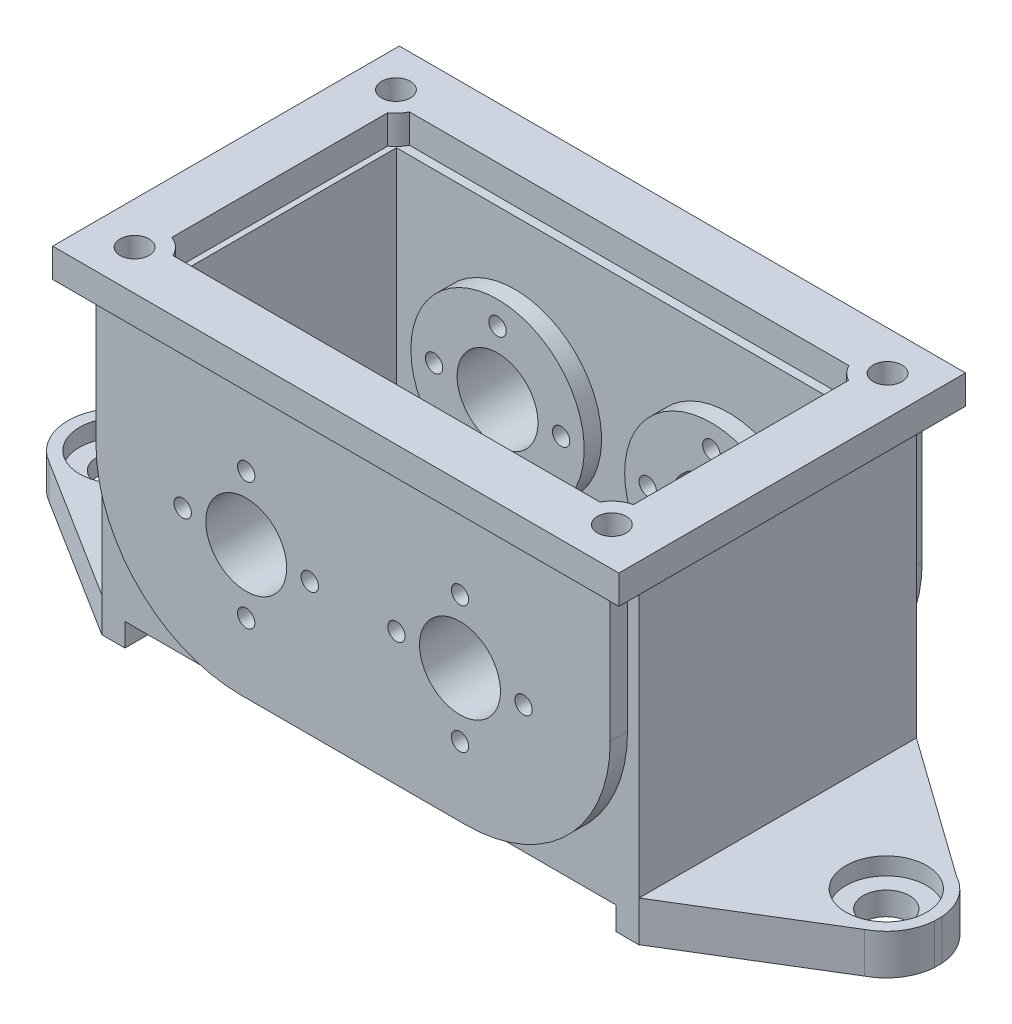
from build123d import *

# Parameters (mm, degrees)
SKETCH1_W            = 93
SKETCH1_H            = 48
BOSS_EXTRUDE1_DEPTH  = 25.5
BOSS_EXTRUDE4_DEPTH  = 3
BOSS_EXTRUDE5_START  = 3
BOSS_EXTRUDE5_DEPTH  = 3
SKETCH5_W            = 78
SKETCH5_H            = 39
CUT_EXTRUDE1_DEPTH   = 44
SKETCH6_W            = 48.017272351
SKETCH6_H            = 7
BOSS_EXTRUDE6_DEPTH  = 29
SKETCH7_W            = 48
SKETCH7_H            = 5.960965096
BOSS_EXTRUDE7_DEPTH  = 29
CUT_EXTRUDE2_DEPTH   = 29
CUT_EXTRUDE3_DEPTH   = 29
SKETCH10_R           = 15
BOSS_EXTRUDE8_DEPTH  = 10.5
SKETCH11_R           = 15
BOSS_EXTRUDE9_DEPTH  = 10.5
SKETCH12_W           = 4
SKETCH12_H           = 48
BOSS_EXTRUDE10_DEPTH = 4
SKETCH13_W           = 4
SKETCH13_H           = 48
BOSS_EXTRUDE11_DEPTH = 4
SKETCH14_R           = 15
BOSS_EXTRUDE12_DEPTH = 10.5
SKETCH15_R           = 15
BOSS_EXTRUDE13_DEPTH = 10.5
SKETCH17_R           = 7
CUT_EXTRUDE4_DEPTH   = 10.5
CUT_EXTRUDE5_START   = -10.5
SKETCH18_R           = 7
CUT_EXTRUDE5_DEPTH   = 10.5
SKETCH19_R           = 7
CUT_EXTRUDE6_DEPTH   = 10.5
CUT_EXTRUDE7_START   = -10.5
SKETCH20_R           = 7
CUT_EXTRUDE7_DEPTH   = 10.5
SKETCH21_R           = 1.5
CUT_EXTRUDE8_DEPTH   = 10.5
SKETCH22_R           = 1.5
CUT_EXTRUDE9_DEPTH   = 89.5
SKETCH23_R           = 1.5
CUT_EXTRUDE10_DEPTH  = 89.5
SKETCH24_R           = 1.5
CUT_EXTRUDE11_DEPTH  = 89.5
CUT_EXTRUDE12_START  = -89.5
SKETCH25_R           = 1.5
CUT_EXTRUDE12_DEPTH  = 89.5
SKETCH26_R           = 1.5
CUT_EXTRUDE13_DEPTH  = 89.5
SKETCH27_R           = 1.5
CUT_EXTRUDE14_DEPTH  = 89.5
SKETCH28_R           = 1.5
CUT_EXTRUDE15_DEPTH  = 89.5
SKETCH29_R           = 1.5
CUT_EXTRUDE16_DEPTH  = 89.5
SKETCH30_W           = 98
SKETCH30_H           = 60
BOSS_EXTRUDE14_DEPTH = 5
SKETCH31_W           = 80
SKETCH31_H           = 42
CUT_EXTRUDE18_DEPTH  = 5
SKETCH32_R           = 5
BOSS_EXTRUDE16_DEPTH = 4
SKETCH33_R           = 5
BOSS_EXTRUDE18_DEPTH = 6
SKETCH34_R           = 5
BOSS_EXTRUDE19_DEPTH = 5
SKETCH35_R           = 5
BOSS_EXTRUDE20_DEPTH = 4
SKETCH36_R           = 2.5
CUT_EXTRUDE19_DEPTH  = 4
SKETCH37_R           = 2.5
CUT_EXTRUDE20_DEPTH  = 4
SKETCH38_R           = 2.5
CUT_EXTRUDE21_DEPTH  = 4
SKETCH39_R           = 2.5
CUT_EXTRUDE22_DEPTH  = 4
SKETCH40_R           = 7
CUT_EXTRUDE23_DEPTH  = 3
SKETCH41_R           = 7
CUT_EXTRUDE24_DEPTH  = 3
SKETCH42_R           = 4
CUT_EXTRUDE25_DEPTH  = 3
SKETCH43_R           = 4
CUT_EXTRUDE26_DEPTH  = 4


with BuildPart() as part:
    # Sketch1 → Boss-Extrude1 (new, symmetric)
    with BuildSketch(Plane(origin=(0, 0, 0), x_dir=(1, 0, 0), z_dir=(0, 1, 0))):
        Rectangle(SKETCH1_W, SKETCH1_H)
    extrude(amount=BOSS_EXTRUDE1_DEPTH, both=True)

    # Sketch3 → Boss-Extrude4 (add)
    with BuildSketch(Plane.XY.offset(24)):
        with BuildLine():
            Line((-44.5, 25.5), (-44.5, 1.5))
            ThreePointArc((-44.5, 1.5), (-37.17766953, -16.17766953), (-19.5, -23.5))
            Line((-19.5, -23.5), (19.5, -23.5))
            ThreePointArc((19.5, -23.5), (37.17766953, -16.17766953), (44.5, 1.5))
            Line((44.5, 1.5), (44.5, 25.5))
            Line((44.5, 25.5), (-44.5, 25.5))
        make_face()
    extrude(amount=BOSS_EXTRUDE4_DEPTH)

    # Sketch4 → Boss-Extrude5 (add)
    with BuildSketch(Plane(origin=(0, 0, -24), x_dir=(-1, 0, 0), z_dir=(0, 0, -1)).offset(BOSS_EXTRUDE5_START)):
        with BuildLine():
            Line((-44.5, 25.5), (-44.5, 1.5))
            ThreePointArc((-44.5, 1.5), (-37.17766953, -16.17766953), (-19.5, -23.5))
            Line((-19.5, -23.5), (19.5, -23.5))
            ThreePointArc((19.5, -23.5), (37.17766953, -16.17766953), (44.5, 1.5))
            Line((44.5, 1.5), (44.5, 25.5))
            Line((44.5, 25.5), (-44.5, 25.5))
        make_face()
    extrude(amount=-BOSS_EXTRUDE5_DEPTH)

    # Sketch5 → Cut-Extrude1 (cut)
    with BuildSketch(Plane(origin=(0, 25.5, 0), x_dir=(1, 0, 0), z_dir=(0, 1, 0))):
        Rectangle(SKETCH5_W, SKETCH5_H)
    extrude(amount=-CUT_EXTRUDE1_DEPTH, mode=Mode.SUBTRACT)

    # Sketch6 → Boss-Extrude6 (add)
    with BuildSketch(Plane(origin=(46.5, 0, 0), x_dir=(0, 0, -1), z_dir=(1, 0, 0))):
        with Locations((0.008636176, -25.960965096)):
            Rectangle(SKETCH6_W, SKETCH6_H)
    extrude(amount=BOSS_EXTRUDE6_DEPTH)

    # Sketch7 → Boss-Extrude7 (add)
    with BuildSketch(Plane.ZY.offset(46.5)):
        with Locations((0, -26.480482548)):
            Rectangle(SKETCH7_W, SKETCH7_H)
    extrude(amount=BOSS_EXTRUDE7_DEPTH)

    # Sketch8 → Cut-Extrude2 (cut)
    with BuildSketch(Plane(origin=(0, -22.460965096, 0), x_dir=(1, 0, 0), z_dir=(0, 1, 0))):
        with BuildLine():
            Line((75.5, -24), (75.5, -1.910676326))
            ThreePointArc((75.5, -1.910676326), (74.051472635, -6.171697745), (70.72097804, -9.198633622))
            Line((70.72097804, -9.198633622), (46.5, -24))
            Line((46.5, -24), (75.5, -24))
        make_face()
        with BuildLine():
            Line((46.5, 24), (70.72097804, 6.725711938))
            ThreePointArc((70.72097804, 6.725711938), (74.051472635, 3.698776061), (75.5, -0.562245358))
            Line((75.5, -0.562245358), (75.5, 24.017272351))
            Line((75.5, 24.017272351), (46.5, 24.017272351))
            Line((46.5, 24.017272351), (46.5, 24))
        make_face()
    extrude(amount=-CUT_EXTRUDE2_DEPTH, mode=Mode.SUBTRACT)

    # Sketch9 → Cut-Extrude3 (cut)
    with BuildSketch(Plane(origin=(0, -23.5, 0), x_dir=(1, 0, 0), z_dir=(0, 1, 0))):
        with BuildLine():
            ThreePointArc((-75.5, -0.15840749), (-74.337484046, 3.643435469), (-71.650459264, 6.57351244))
            Line((-71.650459264, 6.57351244), (-46.5, 24))
            Line((-46.5, 24), (-75.5, 24))
            Line((-75.5, 24), (-75.5, -0.15840749))
        make_face()
        with BuildLine():
            Line((-46.5, -24), (-70.954604818, -8.658460386))
            ThreePointArc((-70.954604818, -8.658460386), (-74.125458012, -5.643733646), (-75.5, -1.489997784))
            Line((-75.5, -1.489997784), (-75.5, -24))
            Line((-75.5, -24), (-46.5, -24))
        make_face()
    extrude(amount=-CUT_EXTRUDE3_DEPTH, mode=Mode.SUBTRACT)

    # Sketch10 → Boss-Extrude8 (add)
    with BuildSketch(Plane(origin=(0, 0, -27), x_dir=(-1, 0, 0), z_dir=(0, 0, -1))):
        with Locations((-18.5, -0.460965096)):
            Circle(SKETCH10_R)
    extrude(amount=-BOSS_EXTRUDE8_DEPTH)

    # Sketch11 → Boss-Extrude9 (add)
    with BuildSketch(Plane(origin=(0, 0, -27), x_dir=(-1, 0, 0), z_dir=(0, 0, -1))):
        with Locations((18.5, -0.460965096)):
            Circle(SKETCH11_R)
    extrude(amount=-BOSS_EXTRUDE9_DEPTH)

    # Sketch12 → Boss-Extrude10 (add)
    with BuildSketch(Plane.XZ.offset(25.5)):
        with Locations((-44.5, 0)):
            Rectangle(SKETCH12_W, SKETCH12_H)
    extrude(amount=BOSS_EXTRUDE10_DEPTH)

    # Sketch13 → Boss-Extrude11 (add)
    with BuildSketch(Plane.XZ.offset(25.5)):
        with Locations((44.5, 0)):
            Rectangle(SKETCH13_W, SKETCH13_H)
    extrude(amount=BOSS_EXTRUDE11_DEPTH)

    # Sketch14 → Boss-Extrude12 (add)
    with BuildSketch(Plane.XY.offset(27)):
        with Locations((-18.5, -0.5)):
            Circle(SKETCH14_R)
    extrude(amount=-BOSS_EXTRUDE12_DEPTH)

    # Sketch15 → Boss-Extrude13 (add)
    with BuildSketch(Plane.XY.offset(27)):
        with Locations((18.5, -0.5)):
            Circle(SKETCH15_R)
    extrude(amount=-BOSS_EXTRUDE13_DEPTH)

    # Sketch17 → Cut-Extrude4 (cut)
    with BuildSketch(Plane(origin=(0, 0, 16.5), x_dir=(-1, 0, 0), z_dir=(0, 0, -1))):
        with Locations((18.5, -0.5)):
            Circle(SKETCH17_R)
    extrude(amount=-CUT_EXTRUDE4_DEPTH, mode=Mode.SUBTRACT)

    # Sketch18 → Cut-Extrude5 (cut)
    with BuildSketch(Plane.XY.offset(-16.5).offset(CUT_EXTRUDE5_START)):
        with Locations((-18.5, -0.5)):
            Circle(SKETCH18_R)
    extrude(amount=CUT_EXTRUDE5_DEPTH, mode=Mode.SUBTRACT)

    # Sketch19 → Cut-Extrude6 (cut)
    with BuildSketch(Plane.XY.offset(-16.5)):
        with Locations((18.5, -0.5)):
            Circle(SKETCH19_R)
    extrude(amount=-CUT_EXTRUDE6_DEPTH, mode=Mode.SUBTRACT)

    # Sketch20 → Cut-Extrude7 (cut)
    with BuildSketch(Plane(origin=(0, 0, 16.5), x_dir=(-1, 0, 0), z_dir=(0, 0, -1)).offset(CUT_EXTRUDE7_START)):
        with Locations((-18.5, -0.5)):
            Circle(SKETCH20_R)
    extrude(amount=CUT_EXTRUDE7_DEPTH, mode=Mode.SUBTRACT)

    # Sketch21 → Cut-Extrude8 (cut)
    with BuildSketch(Plane.XY.offset(27)):
        with Locations((-18.5, 10.5)):
            Circle(SKETCH21_R)
    extrude(amount=-CUT_EXTRUDE8_DEPTH, mode=Mode.SUBTRACT)

    # Sketch22 → Cut-Extrude9 (cut)
    with BuildSketch(Plane.XY.offset(27)):
        with Locations((-7.5, -0.5)):
            Circle(SKETCH22_R)
    extrude(amount=-CUT_EXTRUDE9_DEPTH, mode=Mode.SUBTRACT)

    # Sketch23 → Cut-Extrude10 (cut)
    with BuildSketch(Plane.XY.offset(27)):
        with Locations((-18.5, -11.5)):
            Circle(SKETCH23_R)
    extrude(amount=-CUT_EXTRUDE10_DEPTH, mode=Mode.SUBTRACT)

    # Sketch24 → Cut-Extrude11 (cut)
    with BuildSketch(Plane.XY.offset(27)):
        with Locations((-29.5, -0.5)):
            Circle(SKETCH24_R)
    extrude(amount=-CUT_EXTRUDE11_DEPTH, mode=Mode.SUBTRACT)

    # Sketch25 → Cut-Extrude12 (cut)
    with BuildSketch(Plane(origin=(0, 0, -27), x_dir=(-1, 0, 0), z_dir=(0, 0, -1)).offset(CUT_EXTRUDE12_START)):
        with Locations((18.5, 10.5)):
            Circle(SKETCH25_R)
    extrude(amount=CUT_EXTRUDE12_DEPTH, mode=Mode.SUBTRACT)

    # Sketch26 → Cut-Extrude13 (cut)
    with BuildSketch(Plane.XY.offset(27)):
        with Locations((18.5, 10.5)):
            Circle(SKETCH26_R)
    extrude(amount=-CUT_EXTRUDE13_DEPTH, mode=Mode.SUBTRACT)

    # Sketch27 → Cut-Extrude14 (cut)
    with BuildSketch(Plane.XY.offset(27)):
        with Locations((29.5, -0.5)):
            Circle(SKETCH27_R)
    extrude(amount=-CUT_EXTRUDE14_DEPTH, mode=Mode.SUBTRACT)

    # Sketch28 → Cut-Extrude15 (cut)
    with BuildSketch(Plane.XY.offset(27)):
        with Locations((7.5, -0.5)):
            Circle(SKETCH28_R)
    extrude(amount=-CUT_EXTRUDE15_DEPTH, mode=Mode.SUBTRACT)

    # Sketch29 → Cut-Extrude16 (cut)
    with BuildSketch(Plane.XY.offset(27)):
        with Locations((18.5, -11.5)):
            Circle(SKETCH29_R)
    extrude(amount=-CUT_EXTRUDE16_DEPTH, mode=Mode.SUBTRACT)

    # Sketch30 → Boss-Extrude14 (add)
    with BuildSketch(Plane(origin=(0, 25.5, 0), x_dir=(1, 0, 0), z_dir=(0, 1, 0))):
        Rectangle(SKETCH30_W, SKETCH30_H)
    extrude(amount=BOSS_EXTRUDE14_DEPTH)

    # Sketch31 → Cut-Extrude18 (cut)
    with BuildSketch(Plane(origin=(0, 30.5, 0), x_dir=(1, 0, 0), z_dir=(0, 1, 0))):
        Rectangle(SKETCH31_W, SKETCH31_H)
    extrude(amount=-CUT_EXTRUDE18_DEPTH, mode=Mode.SUBTRACT)

    # Sketch32 → Boss-Extrude16 (add)
    with BuildSketch(Plane(origin=(0, 30.5, 0), x_dir=(1, 0, 0), z_dir=(0, 1, 0))):
        with Locations((-41.75324397, -23.069074946)):
            Circle(SKETCH32_R)
    extrude(amount=-BOSS_EXTRUDE16_DEPTH)

    # Sketch33 → Boss-Extrude18 (add)
    with BuildSketch(Plane(origin=(0, 30.5, 0), x_dir=(1, 0, 0), z_dir=(0, 1, 0))):
        with Locations((-42.754552125, 23.169301943)):
            Circle(SKETCH33_R)
    extrude(amount=-BOSS_EXTRUDE18_DEPTH)

    # Sketch34 → Boss-Extrude19 (add)
    with BuildSketch(Plane(origin=(0, 30.5, 0), x_dir=(1, 0, 0), z_dir=(0, 1, 0))):
        with Locations((42.315201087, 23.191812252)):
            Circle(SKETCH34_R)
    extrude(amount=-BOSS_EXTRUDE19_DEPTH)

    # Sketch35 → Boss-Extrude20 (add)
    with BuildSketch(Plane(origin=(0, 30.5, 0), x_dir=(1, 0, 0), z_dir=(0, 1, 0))):
        with Locations((41.139722354, -23.351644465)):
            Circle(SKETCH35_R)
    extrude(amount=-BOSS_EXTRUDE20_DEPTH)

    # Sketch36 → Cut-Extrude19 (cut)
    with BuildSketch(Plane(origin=(0, 30.5, 0), x_dir=(1, 0, 0), z_dir=(0, 1, 0))):
        with Locations((-42.754552125, 23.169301943)):
            Circle(SKETCH36_R)
    extrude(amount=-CUT_EXTRUDE19_DEPTH, mode=Mode.SUBTRACT)

    # Sketch37 → Cut-Extrude20 (cut)
    with BuildSketch(Plane(origin=(0, 30.5, 0), x_dir=(1, 0, 0), z_dir=(0, 1, 0))):
        with Locations((-41.75324397, -23.069074946)):
            Circle(SKETCH37_R)
    extrude(amount=-CUT_EXTRUDE20_DEPTH, mode=Mode.SUBTRACT)

    # Sketch38 → Cut-Extrude21 (cut)
    with BuildSketch(Plane(origin=(0, 30.5, 0), x_dir=(1, 0, 0), z_dir=(0, 1, 0))):
        with Locations((41.139722354, -23.351644465)):
            Circle(SKETCH38_R)
    extrude(amount=-CUT_EXTRUDE21_DEPTH, mode=Mode.SUBTRACT)

    # Sketch39 → Cut-Extrude22 (cut)
    with BuildSketch(Plane(origin=(0, 30.5, 0), x_dir=(1, 0, 0), z_dir=(0, 1, 0))):
        with Locations((42.315201087, 23.191812252)):
            Circle(SKETCH39_R)
    extrude(amount=-CUT_EXTRUDE22_DEPTH, mode=Mode.SUBTRACT)

    # Sketch40 → Cut-Extrude23 (cut)
    with BuildSketch(Plane(origin=(0, -22.460965096, 0), x_dir=(1, 0, 0), z_dir=(0, 1, 0))):
        with Locations((66.525289226, -1.236460842)):
            Circle(SKETCH40_R)
    extrude(amount=-CUT_EXTRUDE23_DEPTH, mode=Mode.SUBTRACT)

    # Sketch41 → Cut-Extrude24 (cut)
    with BuildSketch(Plane(origin=(0, -23.5, 0), x_dir=(1, 0, 0), z_dir=(0, 1, 0))):
        with Locations((-66.524660629, -0.824202637)):
            Circle(SKETCH41_R)
    extrude(amount=-CUT_EXTRUDE24_DEPTH, mode=Mode.SUBTRACT)

    # Sketch42 → Cut-Extrude25 (cut)
    with BuildSketch(Plane(origin=(0, -26.5, 0), x_dir=(1, 0, 0), z_dir=(0, 1, 0))):
        with Locations((-66.524660629, -0.824202637)):
            Circle(SKETCH42_R)
    extrude(amount=-CUT_EXTRUDE25_DEPTH, mode=Mode.SUBTRACT)

    # Sketch43 → Cut-Extrude26 (cut)
    with BuildSketch(Plane(origin=(0, -25.460965096, 0), x_dir=(1, 0, 0), z_dir=(0, 1, 0))):
        with Locations((66.525289226, -1.236460842)):
            Circle(SKETCH43_R)
    extrude(amount=-CUT_EXTRUDE26_DEPTH, mode=Mode.SUBTRACT)


solid = part.part
